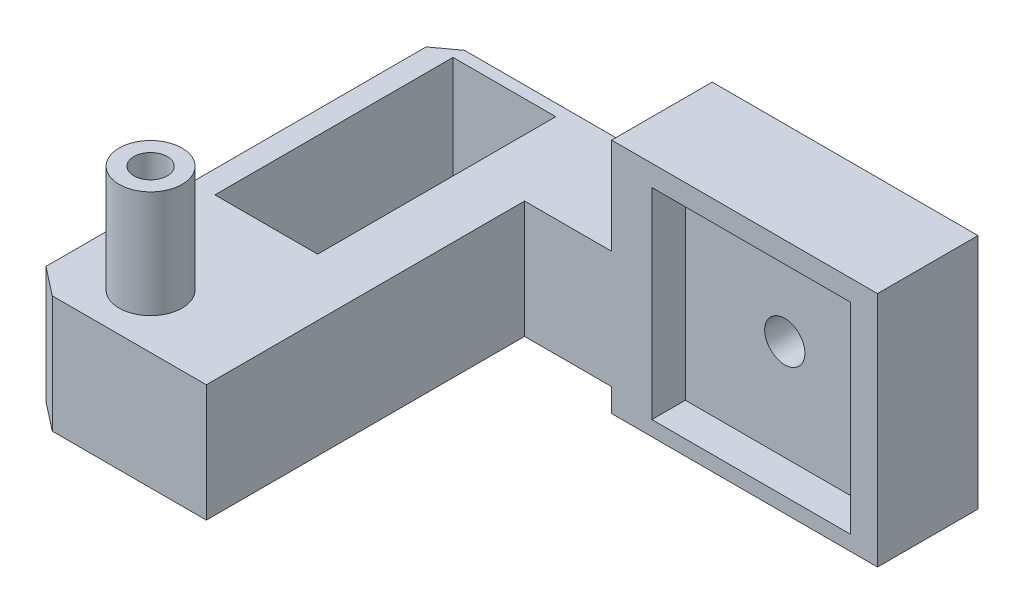
from build123d import *

# Parameters (mm, degrees)
SKETCH1_W            = 55
SKETCH1_H            = 55
SKETCH1_W_2          = 30
SKETCH1_H_2          = 30
BOSS_EXTRUDE1_DEPTH  = 15
SKETCH5_W            = 70
SKETCH5_H            = 70
BOSS_EXTRUDE4_DEPTH  = 17.5
CUT_EXTRUDE1_DEPTH   = 143.483240955
SKETCH8_W            = 15.334329656
SKETCH8_H            = 35.542805721
CUT_EXTRUDE3_DEPTH   = 126.3514749
SKETCH9_R            = 4.7
BOSS_EXTRUDE5_DEPTH  = 16
SKETCH10_R           = 2.5
CUT_EXTRUDE4_DEPTH   = 10
SKETCH12_W           = 30
SKETCH12_H           = 30
BOSS_EXTRUDE6_DEPTH  = 5
SKETCH15_W           = 55
SKETCH15_H           = 15
BOSS_EXTRUDE7_DEPTH  = 18.75
SKETCH16_W           = 30
SKETCH16_H           = 30
BOSS_EXTRUDE8_DEPTH  = 10
SKETCH18_W           = 55
SKETCH18_H           = 18.75
CUT_EXTRUDE6_DEPTH   = 119.922964864
SKETCH20_W           = 15
SKETCH20_H           = 18.75
BOSS_EXTRUDE9_DEPTH  = 12
SKETCH21_W           = 12
SKETCH21_H           = 55
CUT_EXTRUDE9_DEPTH   = 119.330278287
SKETCH23_W           = 48.677589722
SKETCH23_H           = 9.375
CUT_EXTRUDE11_DEPTH  = 110.913811483
CUT_EXTRUDE13_DEPTH  = 116.802667864
SKETCH26_W           = 15
SKETCH26_H           = 9.375
CUT_EXTRUDE14_DEPTH  = 13
CUT_EXTRUDE15_DEPTH  = 111.026884691
SKETCH28_W           = 35.677589722
SKETCH28_H           = 15
BOSS_EXTRUDE10_DEPTH = 5
SKETCH22_W           = 30
SKETCH22_H           = 30
CUT_EXTRUDE16_DEPTH  = 5
SKETCH30_W           = 35.677589722
SKETCH30_H           = 5.896456585
CUT_EXTRUDE18_DEPTH  = 100.094209449
SKETCH32_W           = 15
SKETCH32_H           = 35.353543415
BOSS_EXTRUDE12_DEPTH = 4
SKETCH33_R           = 3
CUT_EXTRUDE19_DEPTH  = 102.585738893


with BuildPart() as part:
    # Sketch1 → Boss-Extrude1 (new body)
    with BuildSketch(Plane.XY):
        with Locations((-13.749602036, -10.640258422)):
            Rectangle(SKETCH1_W, SKETCH1_H)
        with Locations((-13.749602036, -10.640258422)):
            Rectangle(SKETCH1_W_2, SKETCH1_H_2, mode=Mode.SUBTRACT)
    extrude(amount=BOSS_EXTRUDE1_DEPTH)

    # Sketch12 → Boss-Extrude6 (add)
    with BuildSketch(Plane(origin=(-732.77025481, -892.317517431, 5), x_dir=(1, 0, 0), z_dir=(0, 0, 1))):
        with Locations((719.020652774, 881.677259009)):
            Rectangle(SKETCH12_W, SKETCH12_H)
    extrude(amount=-BOSS_EXTRUDE6_DEPTH)



with BuildPart() as body_2:
    # Sketch5 → Boss-Extrude4 (new body)
    with BuildSketch(Plane(origin=(0, 16.859741578, 0), x_dir=(1, 0, 0), z_dir=(0, 1, 0))):
        with Locations((-76.249602036, -35)):
            Rectangle(SKETCH5_W, SKETCH5_H)
    extrude(amount=-BOSS_EXTRUDE4_DEPTH)

    # Sketch6 → Cut-Extrude1 (cut, through all)
    with BuildSketch(Plane(origin=(0, 16.859741578, 0), x_dir=(1, 0, 0), z_dir=(0, 1, 0))):
        Polygon((-77.220552794, 0), (-111.249602036, 0), (-111.249602036, -70), (-76.249602036, -70), (-88.249602036, -61.428571429), (-88.249602036, -8.102672193), align=None)
    extrude(amount=-CUT_EXTRUDE1_DEPTH, mode=Mode.SUBTRACT)

    # Sketch8 → Cut-Extrude3 (cut, through all)
    with BuildSketch(Plane(origin=(0, 16.859741578, 0), x_dir=(1, 0, 0), z_dir=(0, 1, 0))):
        with Locations((-69.49219179, -19.543404801)):
            Rectangle(SKETCH8_W, SKETCH8_H)
    extrude(amount=-CUT_EXTRUDE3_DEPTH, mode=Mode.SUBTRACT)

    # Sketch9 → Boss-Extrude5 (add)
    with BuildSketch(Plane(origin=(0, 16.859741578, 0), x_dir=(1, 0, 0), z_dir=(0, 1, 0))):
        with Locations(Location((-69.665580404, -54.408733969, 0), (0, 0, 270))):
            Circle(SKETCH9_R)
    extrude(amount=BOSS_EXTRUDE5_DEPTH)

    # Sketch10 → Cut-Extrude4 (cut)
    with BuildSketch(Plane(origin=(0, 32.859741578, 0), x_dir=(1, 0, 0), z_dir=(0, 1, 0))):
        with Locations(Location((-69.665580404, -54.408733969, 0), (0, 0, 270))):
            Circle(SKETCH10_R)
    extrude(amount=-CUT_EXTRUDE4_DEPTH, mode=Mode.SUBTRACT)


with BuildPart() as part_1:
    add(part.part)

    add(body_2.part)  # Boss-Extrude7 merges body 2
    # Sketch15 → Boss-Extrude7 (add)
    with BuildSketch(Plane(origin=(0, 16.859741578, 0), x_dir=(1, 0, 0), z_dir=(0, 1, 0))):
        with Locations((-13.749602036, -7.5)):
            Rectangle(SKETCH15_W, SKETCH15_H)
    extrude(amount=BOSS_EXTRUDE7_DEPTH)

    # Sketch16 → Boss-Extrude8 (add)
    with BuildSketch(Plane.XY.offset(15)):
        with Locations((-13.749602036, -10.640258422)):
            Rectangle(SKETCH16_W, SKETCH16_H)
    extrude(amount=-BOSS_EXTRUDE8_DEPTH)

    # Sketch18 → Cut-Extrude6 (cut, through all)
    with BuildSketch(Plane(origin=(0, 0, 0), x_dir=(-1, 0, 0), z_dir=(0, 0, -1))):
        with Locations((13.749602036, -28.765258422)):
            Rectangle(SKETCH18_W, SKETCH18_H)
    extrude(amount=-CUT_EXTRUDE6_DEPTH, mode=Mode.SUBTRACT)

    # Sketch20 → Boss-Extrude9 (add)
    with BuildSketch(Plane.ZY.offset(41.249602036)):
        with Locations((7.5, 26.234741578)):
            Rectangle(SKETCH20_W, SKETCH20_H)
        with Locations((7.5, -10.015258422)):
            Rectangle(SKETCH20_W, SKETCH20_H)
    extrude(amount=BOSS_EXTRUDE9_DEPTH)

    # Sketch21 → Cut-Extrude9 (cut, through all)
    with BuildSketch(Plane(origin=(0, 16.859741578, 0), x_dir=(1, 0, 0), z_dir=(0, 1, 0))):
        with Locations((-47.249602036, -42.5)):
            Rectangle(SKETCH21_W, SKETCH21_H)
    extrude(amount=-CUT_EXTRUDE9_DEPTH, mode=Mode.SUBTRACT)

    # Sketch23 → Cut-Extrude11 (cut, through all)
    with BuildSketch(Plane.XY.offset(15)):
        with Locations((-28.910807175, -14.702758422)):
            Rectangle(SKETCH23_W, SKETCH23_H)
        with Locations((-28.910807175, 30.922241578)):
            Rectangle(SKETCH23_W, SKETCH23_H)
        Polygon((13.750397964, -19.390258422), (13.750397964, 35.609741578), (-4.572012314, 35.609741578), (-4.572012314, 26.234741578), (-4.572012314, -10.015258422), (-4.572012314, -19.390258422), align=None)
    extrude(amount=-CUT_EXTRUDE11_DEPTH, mode=Mode.SUBTRACT)

    # Sketch25 → Cut-Extrude13 (cut, through all)
    with BuildSketch(Plane(origin=(0, 16.859741578, 0), x_dir=(1, 0, 0), z_dir=(0, 1, 0))):
        Polygon((-80.521113565, -2.424811187), (-88.249602036, -8.102672193), (-88.249602036, -61.428571429), (-80.521113565, -66.948920336), align=None)
    extrude(amount=-CUT_EXTRUDE13_DEPTH, mode=Mode.SUBTRACT)

    # Sketch26 → Cut-Extrude14 (cut)
    with BuildSketch(Plane.ZY.offset(53.249602036)):
        with Locations((7.5, 21.547241578)):
            Rectangle(SKETCH26_W, SKETCH26_H)
    extrude(amount=-CUT_EXTRUDE14_DEPTH, mode=Mode.SUBTRACT)

    # Sketch27 → Cut-Extrude15 (cut, through all)
    with BuildSketch(Plane(origin=(0, 16.859741578, 0), x_dir=(1, 0, 0), z_dir=(0, 1, 0))):
        Polygon((-53.249602036, -70), (-53.249602036, -62.5), (-76.249602036, -62.5), (-80.521113565, -59.162729439), (-80.521113565, -66.948920336), (-76.249602036, -70), align=None)
    extrude(amount=-CUT_EXTRUDE15_DEPTH, mode=Mode.SUBTRACT)

    # Sketch28 → Boss-Extrude10 (add)
    with BuildSketch(Plane(origin=(0, 26.234741578, 0), x_dir=(1, 0, 0), z_dir=(0, 1, 0))):
        with Locations((-22.410807175, -7.5)):
            Rectangle(SKETCH28_W, SKETCH28_H)
    extrude(amount=BOSS_EXTRUDE10_DEPTH)

    # Sketch22 → Cut-Extrude16 (cut)
    with BuildSketch(Plane.XY.offset(15)):
        with Locations((-19.249602036, 13.109741578)):
            Rectangle(SKETCH22_W, SKETCH22_H)
    extrude(amount=-CUT_EXTRUDE16_DEPTH, mode=Mode.SUBTRACT)

    # Sketch30 → Cut-Extrude18 (cut, through all)
    with BuildSketch(Plane.XY.offset(15)):
        Polygon((-40.249602036, -0.640258422), (-53.249602036, -0.640258422), (-53.249602036, -10.015258422), (-40.249602036, -10.015258422), (-40.249602036, -4.118801837), align=None)
        with Locations((-22.410807175, -7.06703013)):
            Rectangle(SKETCH30_W, SKETCH30_H)
    extrude(amount=-CUT_EXTRUDE18_DEPTH, mode=Mode.SUBTRACT)

    # Sketch32 → Boss-Extrude12 (add)
    with BuildSketch(Plane(origin=(-4.572012314, 0, 0), x_dir=(0, 0, -1), z_dir=(1, 0, 0))):
        with Locations((-7.5, 13.557969871)):
            Rectangle(SKETCH32_W, SKETCH32_H)
    extrude(amount=BOSS_EXTRUDE12_DEPTH)

    # Sketch33 → Cut-Extrude19 (cut, through all)
    with BuildSketch(Plane.XY.offset(10)):
        with Locations((-19.410807175, 13.109741578)):
            Circle(SKETCH33_R)
    extrude(amount=-CUT_EXTRUDE19_DEPTH, mode=Mode.SUBTRACT)


solid = part_1.part
